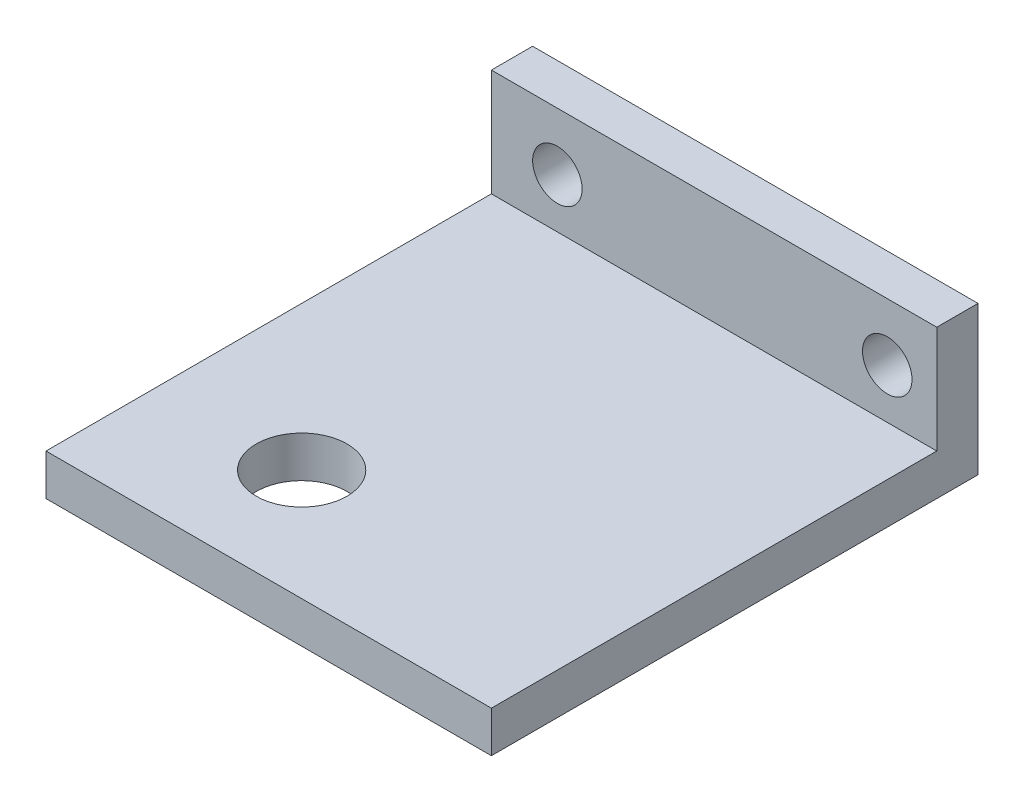
from build123d import *

# Parameters (mm, degrees)
ESQUISSE1_W             = 54
ESQUISSE1_H             = 18
ESQUISSE1_R             = 3
BOSS_EXTRU_1_DEPTH      = 59
ESQUISSE2_W             = 89.885876072
ESQUISSE2_H             = 74.564815434
ENL_V_MAT_EXTRU_1_DEPTH = 13
D_GAGEMENT_M101_D       = 11


with BuildPart() as part:
    # Esquisse1 → Boss.-Extru.1 (new body)
    with BuildSketch(Plane.XY):
        Rectangle(ESQUISSE1_W, ESQUISSE1_H)
        with Locations((-19, 2)):
            Circle(ESQUISSE1_R, mode=Mode.SUBTRACT)
        with Locations((21, 2)):
            Circle(ESQUISSE1_R, mode=Mode.SUBTRACT)
    extrude(amount=BOSS_EXTRU_1_DEPTH)

    # Esquisse2 → Enlèv. mat.-Extru.1 (cut)
    with BuildSketch(Plane(origin=(0, 9, 0), x_dir=(1, 0, 0), z_dir=(0, 1, 0))):
        with Locations((-2.437014962, -42.282407717)):
            Rectangle(ESQUISSE2_W, ESQUISSE2_H)
    extrude(amount=-ENL_V_MAT_EXTRU_1_DEPTH, mode=Mode.SUBTRACT)

    # Dégagement M101 (through all)
    with Locations(Plane(origin=(0, -4, 0), x_dir=(1, 0, 0), z_dir=(0, 1, 0))):
        with Locations((-9.499999599, -45.502210499)):
            Hole(D_GAGEMENT_M101_D / 2)


solid = part.part
